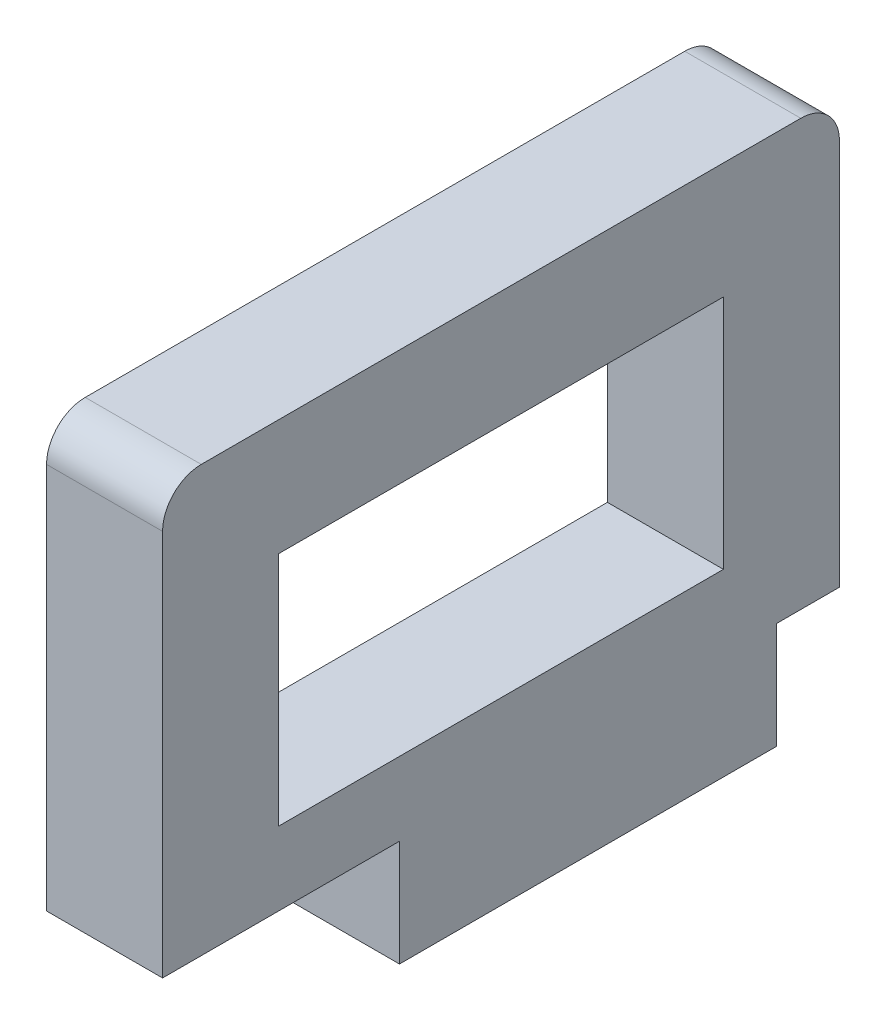
from build123d import *

# Parameters (mm, degrees)
SKETCH1_W           = 23
SKETCH1_H           = 12.2
BOSS_EXTRUDE1_DEPTH = 6
FILLET1_R           = 2


with BuildPart() as part:
    # Sketch1 → Boss-Extrude1 (new body)
    with BuildSketch(Plane(origin=(0, 0, 0), x_dir=(0, 0, -1), z_dir=(1, 0, 0))):
        Polygon((17.5, -9.9), (17.5, 12.1), (-17.5, 12.1), (-17.5, -9.9), (-5.25, -9.9), (-5.25, -15.4), (14.25, -15.4), (14.25, -9.9), align=None)
        Rectangle(SKETCH1_W, SKETCH1_H, mode=Mode.SUBTRACT)
    extrude(amount=BOSS_EXTRUDE1_DEPTH)

    # Fillet1
    fillet1_edges = [part.edges().sort_by_distance(p)[0] for p in [
        (3, 12.1, -17.5),
        (3, 12.1, 17.5),
    ]]
    fillet(fillet1_edges, radius=FILLET1_R)


solid = part.part
